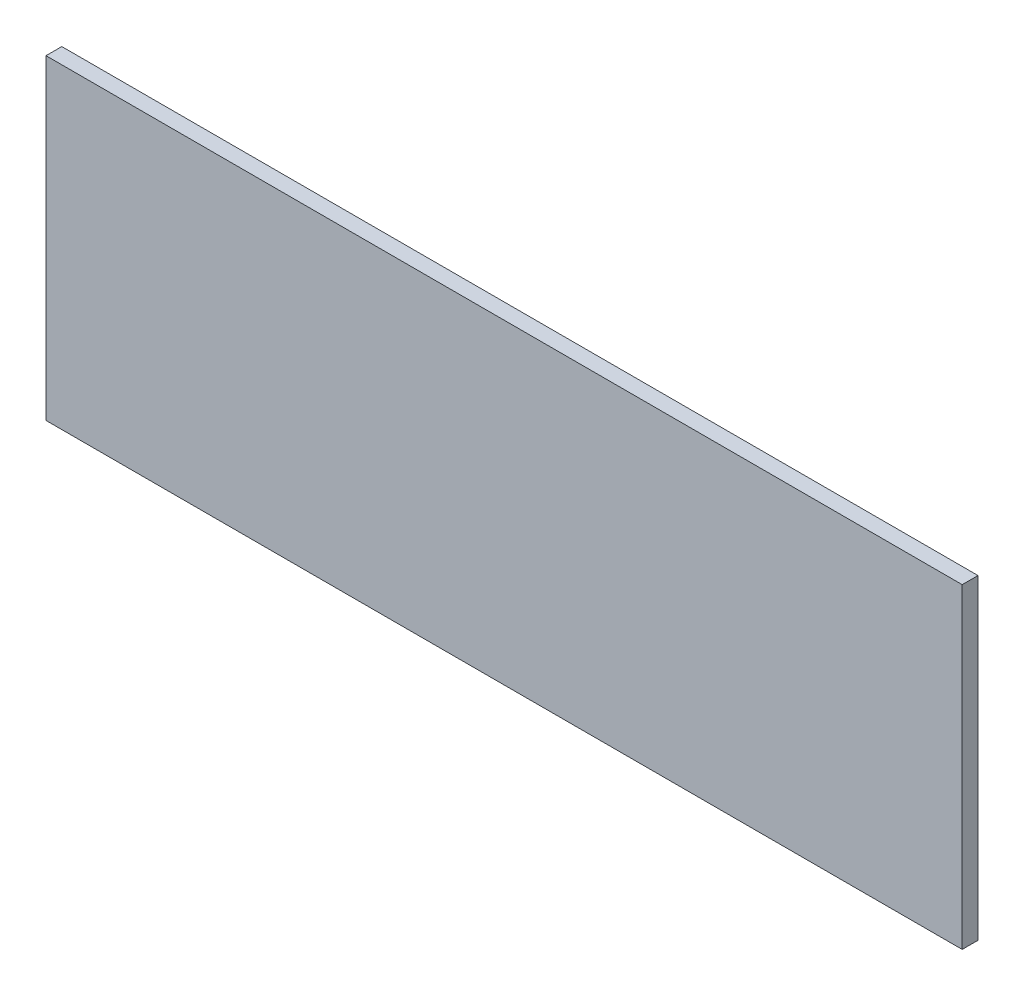
from build123d import *

# Parameters (mm, degrees)
SKIZZE1_W                       = 290
SKIZZE1_H                       = 100
AUFSATZ_LINEAR_AUSTRAGEN1_DEPTH = 5


with BuildPart() as part:
    # Skizze1 → Aufsatz-Linear austragen1 (new body)
    with BuildSketch(Plane.XY):
        Rectangle(SKIZZE1_W, SKIZZE1_H)
    extrude(amount=AUFSATZ_LINEAR_AUSTRAGEN1_DEPTH)


solid = part.part
